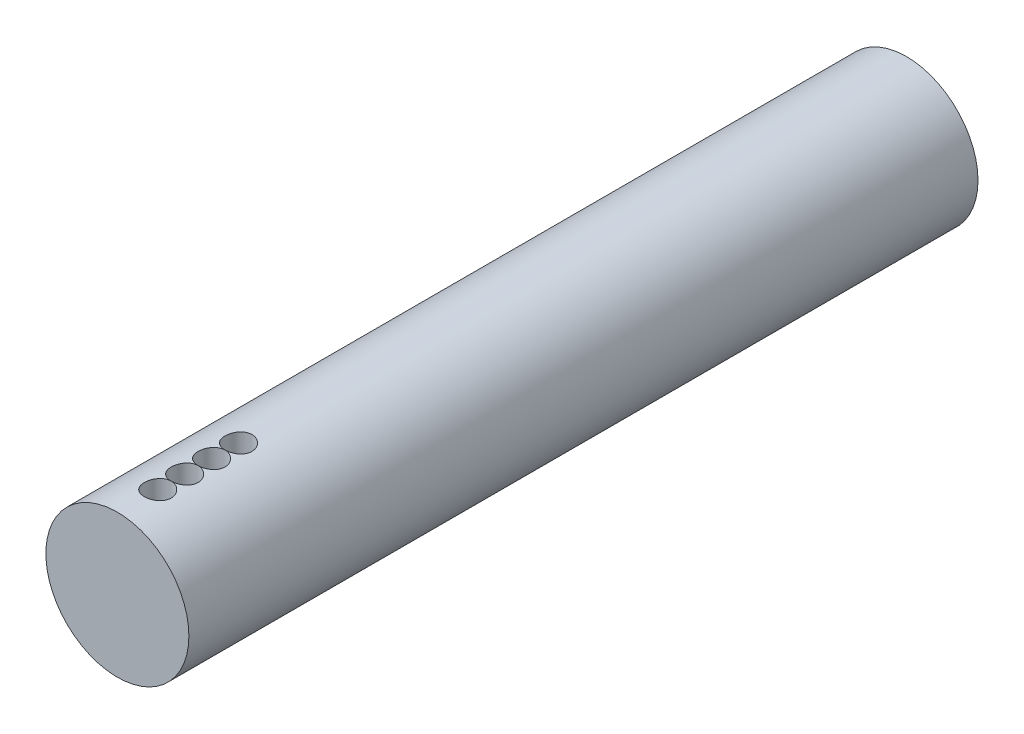
from build123d import *

# Parameters (mm, degrees)
SKETCH1_R               = 7.975
BOSS_EXTRUDE1_DEPTH     = 44
SKETCH2_R               = 1.5
CUT_EXTRUDE1_DEPTH      = 46.422475164
LPATTERN3_PLANET2_COUNT = 4
LPATTERN3_PLANET2_PITCH = 3.001


with BuildPart() as part:
    # Sketch1 → Boss-Extrude1 (new, symmetric)
    with BuildSketch(Plane.XY):
        Circle(SKETCH1_R)
    extrude(amount=BOSS_EXTRUDE1_DEPTH, both=True)

    # Sketch2 → Cut-Extrude1 (cut, symmetric)
    with BuildSketch(Plane(origin=(0, 0, 0), x_dir=(1, 0, 0), z_dir=(0, 1, 0))):
        with Locations(Location((0, -39.5, 0), (0, 0, 270))):
            Circle(SKETCH2_R)
    cut_extrude1 = extrude(amount=CUT_EXTRUDE1_DEPTH, both=True, mode=Mode.SUBTRACT)

    # LPattern3-Planet2: Cut-Extrude1 ×4
    with Locations(*[(0, 0, -i * LPATTERN3_PLANET2_PITCH) for i in range(1, LPATTERN3_PLANET2_COUNT)]):
        add(cut_extrude1, mode=Mode.SUBTRACT)


solid = part.part
